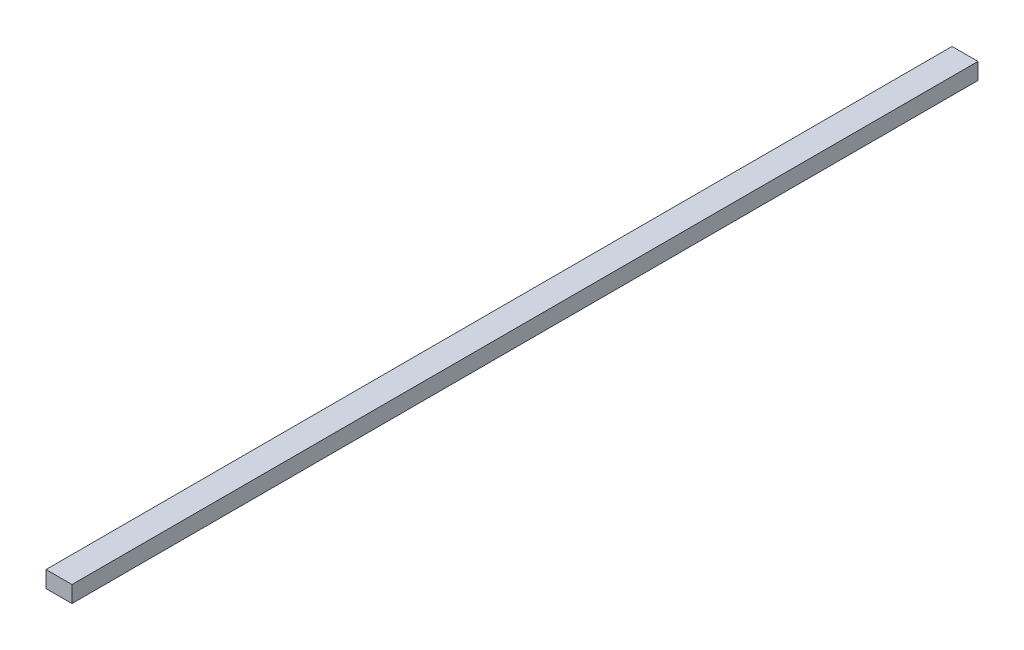
from build123d import *

# Parameters (mm, degrees)
SKETCH1_W           = 139.7
SKETCH1_H           = 88.9
BOSS_EXTRUDE1_DEPTH = 4876.8


with BuildPart() as part:
    # Sketch1 → Boss-Extrude1 (new body)
    with BuildSketch(Plane.XY):
        Rectangle(SKETCH1_W, SKETCH1_H)
    extrude(amount=BOSS_EXTRUDE1_DEPTH)


solid = part.part
